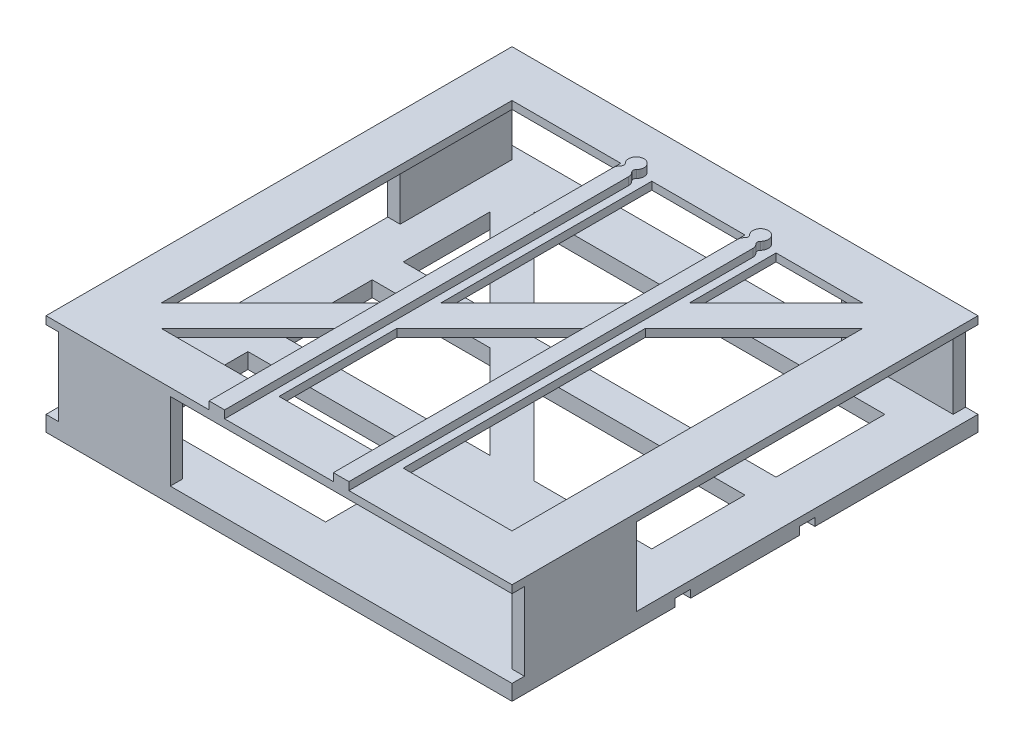
from build123d import *

# Parameters (mm, degrees)
SKETCH_1_W      = 120
SKETCH_1_H      = 70
EXTRUDE_1_DEPTH = 5
SKETCH_2_W      = 120
SKETCH_2_H      = 70
EXTRUDE_2_DEPTH = 5
SKETCH_3_W      = 8
SKETCH_3_H      = 72
SKETCH_3_W_2    = 72
SKETCH_3_H_2    = 8
EXTRUDE_3_DEPTH = 50
SKETCH_4_W      = 300
SKETCH_4_H      = 300
EXTRUDE_4_DEPTH = 5
EXTRUDE_5_DEPTH = 5


with BuildPart() as part:
    # 草图1 → 凸台-拉伸1 (new body)
    with BuildSketch(Plane(origin=(0, 0, 0), x_dir=(1, 0, 0), z_dir=(0, 1, 0))):
        Polygon((-150, 150), (150, 150), (150, -30), (150, -150), (0, -150), (-150, -150), align=None)
        Polygon((-15.857864376, 30), (120, 30), (120, -30), (44.142135624, -30), align=None, mode=Mode.SUBTRACT)
        Polygon((-105.857864376, 120), (120, 120), (120, 50), (-35.857864376, 50), align=None, mode=Mode.SUBTRACT)
        Polygon((-120, 105.857864376), (-120, 50), (-64.142135624, 50), align=None, mode=Mode.SUBTRACT)
        with Locations((-60, -85)):
            Rectangle(SKETCH_1_W, SKETCH_1_H, mode=Mode.SUBTRACT)
        Polygon((-120, 30), (-44.142135624, 30), (15.857864376, -30), (-120, -30), align=None, mode=Mode.SUBTRACT)
    extrude(amount=EXTRUDE_1_DEPTH)

    # 草图2 → 凸台-拉伸2 (add)
    with BuildSketch(Plane.XZ):
        with BuildLine():
            Line((150, 45), (150, 150))
            Line((150, 150), (-150, 150))
            Line((-150, 150), (-150, -150))
            Line((-150, -150), (150, -150))
            Line((150, -150), (150, -45))
            Line((150, -45), (-110, -45))
            ThreePointArc((-110, -45), (-111.913417162, -44.619397663), (-113.535533906, -43.535533906))
            ThreePointArc((-113.535533906, -43.535533906), (-115, -42.928932188), (-116.464466094, -43.535533906))
            ThreePointArc((-116.464466094, -43.535533906), (-125, -40), (-116.464466094, -36.464466094))
            ThreePointArc((-116.464466094, -36.464466094), (-115, -37.071067812), (-113.535533906, -36.464466094))
            ThreePointArc((-113.535533906, -36.464466094), (-111.913417162, -35.380602337), (-110, -35))
            Line((-110, -35), (150, -35))
            Line((150, -35), (150, 35))
            Line((150, 35), (-110, 35))
            ThreePointArc((-110, 35), (-111.913417162, 35.380602337), (-113.535533906, 36.464466094))
            ThreePointArc((-113.535533906, 36.464466094), (-115, 37.071067812), (-116.464466094, 36.464466094))
            ThreePointArc((-116.464466094, 36.464466094), (-125, 40), (-116.464466094, 43.535533906))
            ThreePointArc((-116.464466094, 43.535533906), (-115, 42.928932188), (-113.535533906, 43.535533906))
            ThreePointArc((-113.535533906, 43.535533906), (-111.913417162, 44.619397663), (-110, 45))
            Line((-110, 45), (150, 45))
        make_face()
        with Locations((-60, 85)):
            Rectangle(SKETCH_2_W, SKETCH_2_H, mode=Mode.SUBTRACT)
        Polygon((-120, 30), (-120, -30), (-44.142135624, -30), (15.857864376, 30), align=None, mode=Mode.SUBTRACT)
        Polygon((44.142135624, 30), (-15.857864376, -30), (120, -30), (120, 30), align=None, mode=Mode.SUBTRACT)
        Polygon((-120, -50), (-120, -105.857864376), (-64.142135624, -50), align=None, mode=Mode.SUBTRACT)
        Polygon((-35.857864376, -50), (-105.857864376, -120), (120, -120), (120, -50), align=None, mode=Mode.SUBTRACT)
    extrude(amount=EXTRUDE_2_DEPTH)

    # 草图3 → 凸台-拉伸3 (add)
    with BuildSketch(Plane(origin=(0, 5, 0), x_dir=(1, 0, 0), z_dir=(0, 1, 0))):
        with Locations((146, -106)):
            Rectangle(SKETCH_3_W, SKETCH_3_H)
        with Locations((-106, -146)):
            Rectangle(SKETCH_3_W_2, SKETCH_3_H_2)
        with Locations((-146, 106)):
            Rectangle(SKETCH_3_W, SKETCH_3_H)
        with Locations((106, 146)):
            Rectangle(SKETCH_3_W_2, SKETCH_3_H_2)
    extrude(amount=EXTRUDE_3_DEPTH)

    # 草图4 → 凸台-拉伸4 (add)
    with BuildSketch(Plane(origin=(0, 55, 0), x_dir=(1, 0, 0), z_dir=(0, 1, 0))):
        Rectangle(SKETCH_4_W, SKETCH_4_H)
        Polygon((30, 120), (-30, 120), (-30, -15.857864376), (30, 44.142135624), align=None, mode=Mode.SUBTRACT)
        Polygon((105.857864376, 120), (50, 120), (50, 64.142135624), align=None, mode=Mode.SUBTRACT)
        Polygon((120, 105.857864376), (120, -120), (50, -120), (50, 35.857864376), align=None, mode=Mode.SUBTRACT)
        Polygon((-120, 120), (-120, -105.857864376), (-50, -35.857864376), (-50, 120), align=None, mode=Mode.SUBTRACT)
        Polygon((-50, -120), (-105.857864376, -120), (-50, -64.142135624), align=None, mode=Mode.SUBTRACT)
        Polygon((30, -120), (-30, -120), (-30, -44.142135624), (30, 15.857864376), align=None, mode=Mode.SUBTRACT)
    extrude(amount=EXTRUDE_4_DEPTH)

    # 草图5 → 凸台-拉伸5 (add)
    with BuildSketch(Plane(origin=(0, 60, 0), x_dir=(1, 0, 0), z_dir=(0, 1, 0))):
        with BuildLine():
            Line((35, 110), (35, -150))
            Line((35, -150), (45, -150))
            Line((45, -150), (45, 110))
            ThreePointArc((45, 110), (44.619397663, 111.913417162), (43.535533906, 113.535533906))
            ThreePointArc((43.535533906, 113.535533906), (42.928932188, 115), (43.535533906, 116.464466094))
            ThreePointArc((43.535533906, 116.464466094), (40, 125), (36.464466094, 116.464466094))
            ThreePointArc((36.464466094, 116.464466094), (37.071067812, 115), (36.464466094, 113.535533906))
            ThreePointArc((36.464466094, 113.535533906), (35.380602337, 111.913417162), (35, 110))
        make_face()
        with BuildLine():
            Line((-45, -150), (-35, -150))
            Line((-35, -150), (-35, 110))
            ThreePointArc((-35, 110), (-35.380602337, 111.913417162), (-36.464466094, 113.535533906))
            ThreePointArc((-36.464466094, 113.535533906), (-37.071067812, 115), (-36.464466094, 116.464466094))
            ThreePointArc((-36.464466094, 116.464466094), (-40, 125), (-43.535533906, 116.464466094))
            ThreePointArc((-43.535533906, 116.464466094), (-42.928932188, 115), (-43.535533906, 113.535533906))
            ThreePointArc((-43.535533906, 113.535533906), (-44.619397663, 111.913417162), (-45, 110))
            Line((-45, 110), (-45, -150))
        make_face()
    extrude(amount=EXTRUDE_5_DEPTH)


solid = part.part
